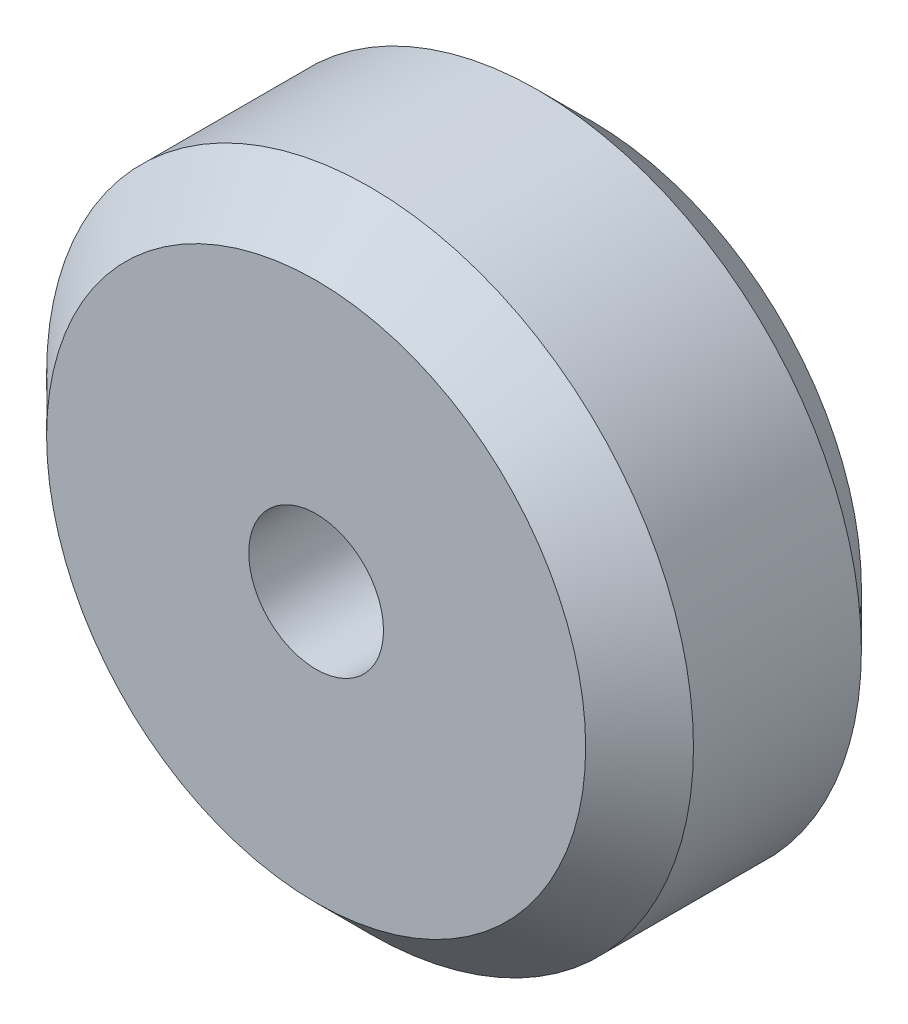
from build123d import *

# Parameters (mm, degrees)
SKETCH2_R           = 12
BOSS_EXTRUDE1_DEPTH = 10.23
SKETCH3_R           = 2.5
CUT_EXTRUDE1_DEPTH  = 20.815471228
CHAMFER1_SIZE       = 2
CHAMFER2_SIZE       = 2


with BuildPart() as part:
    # Sketch2 → Boss-Extrude1 (new body)
    with BuildSketch(Plane.XY):
        Circle(SKETCH2_R)
    extrude(amount=BOSS_EXTRUDE1_DEPTH)

    # Sketch3 → Cut-Extrude1 (cut, through all)
    with BuildSketch(Plane.XY.offset(10.23)):
        Circle(SKETCH3_R)
    extrude(amount=-CUT_EXTRUDE1_DEPTH, mode=Mode.SUBTRACT)

    # Chamfer1
    chamfer1_edges = [part.edges().sort_by_distance(p)[0] for p in [
        (-12, 0, 10.23),
    ]]
    chamfer(chamfer1_edges, length=CHAMFER1_SIZE)

    # Chamfer2
    chamfer2_edges = [part.edges().sort_by_distance(p)[0] for p in [
        (-12, 0, 0),
    ]]
    chamfer(chamfer2_edges, length=CHAMFER2_SIZE)


solid = part.part
